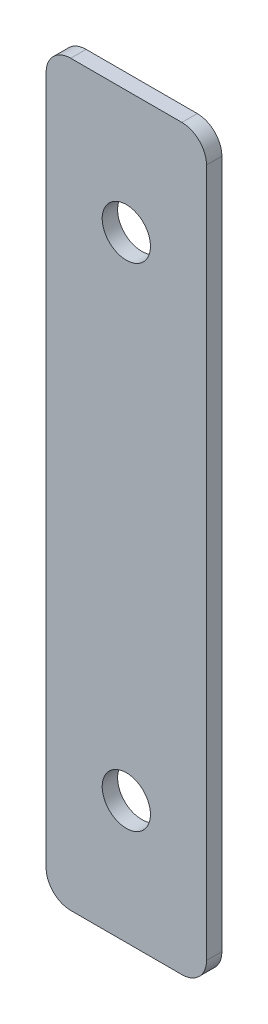
from build123d import *

# Parameters (mm, degrees)
SKETCH1_R           = 2.4892
BOSS_EXTRUDE1_DEPTH = 1.5875


with BuildPart() as part:
    # Sketch1 → Boss-Extrude1 (new body)
    with BuildSketch(Plane.XY):
        with BuildLine():
            Line((5.7404, -56.515), (-5.7404, -56.515))
            ThreePointArc((-5.7404, -56.515), (-7.536451224, -55.771051224), (-8.2804, -53.975))
            Line((-8.2804, -53.975), (-8.2804, 17.145))
            ThreePointArc((-8.2804, 17.145), (-7.536451224, 18.941051224), (-5.7404, 19.685))
            Line((-5.7404, 19.685), (5.7404, 19.685))
            ThreePointArc((5.7404, 19.685), (7.536451224, 18.941051224), (8.2804, 17.145))
            Line((8.2804, 17.145), (8.2804, -53.975))
            ThreePointArc((8.2804, -53.975), (7.536451224, -55.771051224), (5.7404, -56.515))
        make_face()
        with Locations((0, -43.815)):
            Circle(SKETCH1_R, mode=Mode.SUBTRACT)
        with Locations((0, 6.985)):
            Circle(SKETCH1_R, mode=Mode.SUBTRACT)
    extrude(amount=BOSS_EXTRUDE1_DEPTH)


solid = part.part
